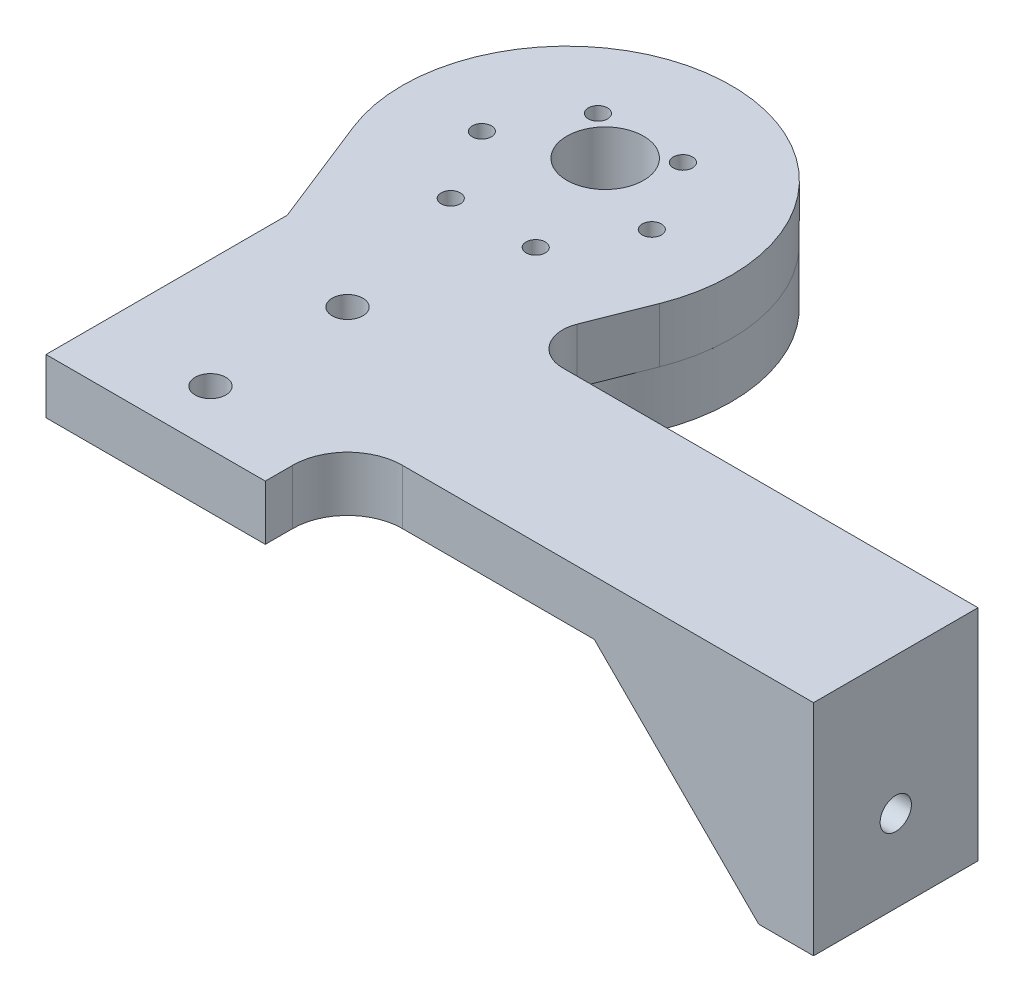
from build123d import *

# Parameters (mm, degrees)
SKETCH1_R           = 2.8
SKETCH1_R_2         = 7
SKETCH1_R_3         = 1.75
BOSS_EXTRUDE1_DEPTH = 10
SKETCH2_R           = 30
SKETCH2_R_2         = 18.7
BOSS_EXTRUDE2_DEPTH = 10
BOSS_EXTRUDE3_DEPTH = 15
FILLET1_R           = 10
FILLET2_R           = 6
SKETCH4_R           = 2.85
CUT_EXTRUDE1_DEPTH  = 30
BOSS_EXTRUDE4_DEPTH = 5
CHAMFER1_SIZE       = 2.5
CHAMFER2_SIZE       = 2.5


with BuildPart() as part:
    # Sketch1 → Boss-Extrude1 (new body)
    with BuildSketch(Plane(origin=(0, 0, 0), x_dir=(1, 0, 0), z_dir=(0, 1, 0))):
        with BuildLine():
            Line((-20, -39), (20, -39))
            Line((20, -39), (20, 5.000681491))
            Line((20, 5.000681491), (27.896886999, 24.965633249))
            ThreePointArc((27.896886999, 24.965633249), (-0.000134778, 65.999951351), (-27.897156555, 24.965633249))
            Line((-27.897156555, 24.965633249), (-20, 5))
            Line((-20, 5), (-20, -39))
        make_face()
        with Locations(Location((0, -29, 0), (0, 0, 270))):
            Circle(SKETCH1_R, mode=Mode.SUBTRACT)
        with Locations(Location((0, 42.999802972, 0), (0, 0, 270))):
            Circle(SKETCH1_R_2, mode=Mode.SUBTRACT)
        with Locations(Location((15.499926834, 35.999990173, 0), (0, 0, 270))):
            Circle(SKETCH1_R_3, mode=Mode.SUBTRACT)
        with Locations(Location((7.74993935, 22.576589188, 0), (0, 0, 270))):
            Circle(SKETCH1_R_3, mode=Mode.SUBTRACT)
        with Locations(Location((-7.75006065, 22.576574736, 0), (0, 0, 270))):
            Circle(SKETCH1_R_3, mode=Mode.SUBTRACT)
        with Locations(Location((-15.500073166, 35.999961269, 0), (0, 0, 270))):
            Circle(SKETCH1_R_3, mode=Mode.SUBTRACT)
        with Locations(Location((-7.750085682, 49.423362253, 0), (0, 0, 270))):
            Circle(SKETCH1_R_3, mode=Mode.SUBTRACT)
        with Locations(Location((7.749914318, 49.423376705, 0), (0, 0, 270))):
            Circle(SKETCH1_R_3, mode=Mode.SUBTRACT)
        with Locations(Location((0, -4, 0), (0, 0, 270))):
            Circle(SKETCH1_R, mode=Mode.SUBTRACT)
    extrude(amount=BOSS_EXTRUDE1_DEPTH)

    # Sketch2 → Boss-Extrude2 (add)
    with BuildSketch(Plane.XZ):
        with Locations(Location((-0.000109725, -35.999802972, 0), (0, 0, 21.711201864))):
            Circle(SKETCH2_R)
        with Locations(Location((-0.000109725, -35.999802972, 0), (0, 0, 270))):
            Circle(SKETCH2_R_2, mode=Mode.SUBTRACT)
    extrude(amount=BOSS_EXTRUDE2_DEPTH)

    # Sketch3 → Boss-Extrude3 (add, symmetric)
    with BuildSketch(Plane.XY.offset(9)):
        Polygon((20, 10), (105, 10), (105, -30), (95, -30), (95, -3.535533906), (91.464466094, 0), (20, 0), align=None)
    extrude(amount=BOSS_EXTRUDE3_DEPTH, both=True)

    # Fillet1
    fillet1_edges = [part.edges().sort_by_distance(p)[0] for p in [
        (20, 5, 24),
    ]]
    fillet(fillet1_edges, radius=FILLET1_R)

    # Fillet2
    fillet2_edges = [part.edges().sort_by_distance(p)[0] for p in [
        (20.395267939, 5, -6),
    ]]
    fillet(fillet2_edges, radius=FILLET2_R)

    # Sketch4 → Cut-Extrude1 (cut)
    with BuildSketch(Plane(origin=(105, 0, 0), x_dir=(0, 0, -1), z_dir=(1, 0, 0))):
        with Locations((-9, -15)):
            Circle(SKETCH4_R)
    extrude(amount=-CUT_EXTRUDE1_DEPTH, mode=Mode.SUBTRACT)

    # Sketch5 → Boss-Extrude4 (add)
    with BuildSketch(Plane(origin=(0, 0, -6), x_dir=(-1, 0, 0), z_dir=(0, 0, -1))):
        Polygon((-95, -30), (-95, 0), (-65, 0), align=None)
    boss_extrude4 = extrude(amount=-BOSS_EXTRUDE4_DEPTH)

    # Mirror1: Boss-Extrude4 across plane
    add(boss_extrude4.mirror(Plane.XY.offset(9)))

    # Chamfer1
    chamfer1_edges = [part.edges().sort_by_distance(p)[0] for p in [
        (0, 0, 1.2),
    ]]
    chamfer(chamfer1_edges, length=CHAMFER1_SIZE)

    # Chamfer2
    chamfer2_edges = [part.edges().sort_by_distance(p)[0] for p in [
        (0, 0, 26.2),
    ]]
    chamfer(chamfer2_edges, length=CHAMFER2_SIZE)


solid = part.part
